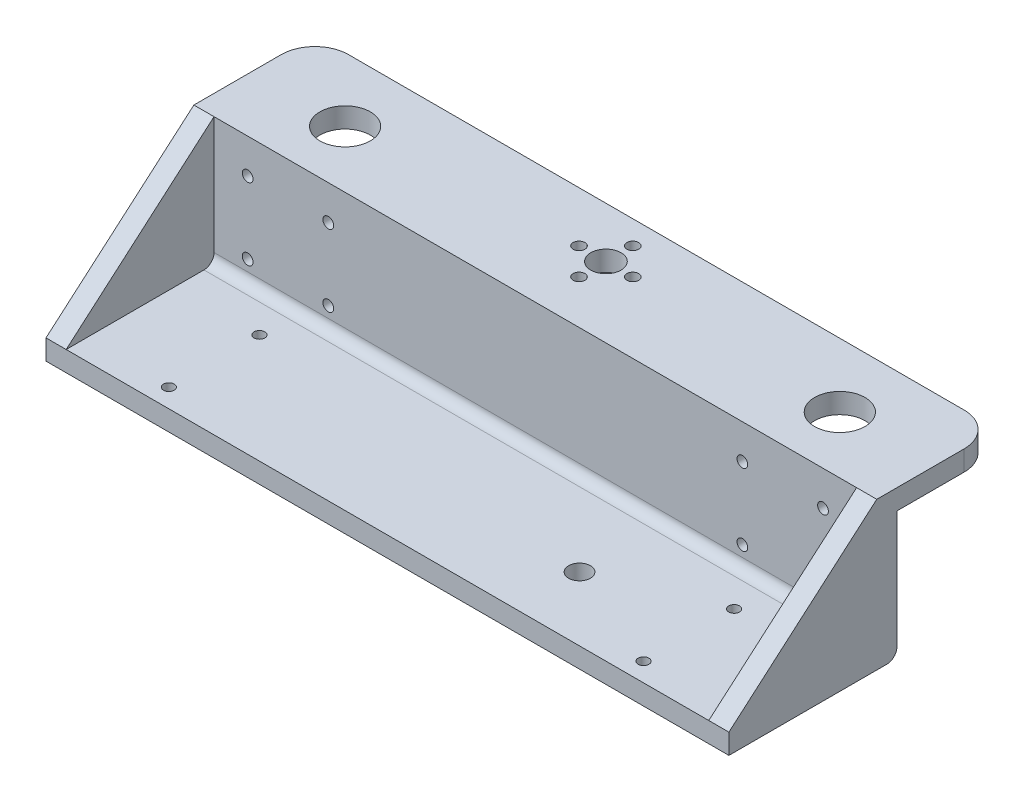
from build123d import *

# Parameters (mm, degrees)
ESQUISSE1_W             = 203.2
ESQUISSE1_H             = 32
BOSS_EXTRU_1_DEPTH      = 6
ESQUISSE2_W             = 203.2
ESQUISSE2_H             = 36
BOSS_EXTRU_2_DEPTH      = 6
ESQUISSE3_R             = 7.5
ESQUISSE3_R_2           = 4.5
ESQUISSE3_R_3           = 1.75
ENL_V_MAT_EXTRU_1_DEPTH = 113.545812894
ESQUISSE6_W             = 203.2
ESQUISSE6_H             = 50
BOSS_EXTRU_4_DEPTH      = 6
BOSS_EXTRU_5_DEPTH      = 6
CONG_3_R                = 3
CONG_4_R                = 10
D_GAGEMENT_M31_D        = 3.2
D_GAGEMENT_M31_DEPTH    = 6
D_GAGEMENT_M31_TIP      = 0.96137699
ESQUISSE11_R            = 3.2385
ENL_V_MAT_EXTRU_3_DEPTH = 6
D_GAGEMENT_M32_D        = 3.2
D_GAGEMENT_M32_DEPTH    = 6
D_GAGEMENT_M32_TIP      = 0.96137699


with BuildPart() as part:
    # Esquisse1 → Boss.-Extru.1 (new body)
    with BuildSketch(Plane.XY):
        Rectangle(ESQUISSE1_W, ESQUISSE1_H)
    extrude(amount=BOSS_EXTRU_1_DEPTH)

    # Esquisse2 → Boss.-Extru.2 (add)
    with BuildSketch(Plane(origin=(0, 16, 0), x_dir=(1, 0, 0), z_dir=(0, 1, 0))):
        with Locations((0, 12)):
            Rectangle(ESQUISSE2_W, ESQUISSE2_H)
    extrude(amount=BOSS_EXTRU_2_DEPTH)

    # Esquisse3 → Enlèv. mat.-Extru.1 (cut, through all)
    with BuildSketch(Plane(origin=(0, 22, 0), x_dir=(1, 0, 0), z_dir=(0, 1, 0))):
        with Locations(Location((-73.6, 11, 0), (0, 0, 270))):
            Circle(ESQUISSE3_R)
        with Locations(Location((73.6, 11, 0), (0, 0, 270))):
            Circle(ESQUISSE3_R)
        with Locations(Location((0, 15, 0), (0, 0, 270))):
            Circle(ESQUISSE3_R_2)
        with Locations(Location((0, 23, 0), (0, 0, 270))):
            Circle(ESQUISSE3_R_3)
        with Locations(Location((0, 7, 0), (0, 0, 270))):
            Circle(ESQUISSE3_R_3)
        with Locations(Location((8, 15, 0), (0, 0, 270))):
            Circle(ESQUISSE3_R_3)
        with Locations(Location((-8, 15, 0), (0, 0, 270))):
            Circle(ESQUISSE3_R_3)
    extrude(amount=-ENL_V_MAT_EXTRU_1_DEPTH, mode=Mode.SUBTRACT)

    # Esquisse6 → Boss.-Extru.4 (add)
    with BuildSketch(Plane.XZ.offset(16)):
        with Locations((0, 25)):
            Rectangle(ESQUISSE6_W, ESQUISSE6_H)
    extrude(amount=BOSS_EXTRU_4_DEPTH)

    # Esquisse7 → Boss.-Extru.5 (add)
    with BuildSketch(Plane(origin=(101.6, 0, 0), x_dir=(0, 0, -1), z_dir=(1, 0, 0))):
        Polygon((-50, -16), (-6, 22), (0, 22), (0, -16), align=None)
    boss_extru_5 = extrude(amount=-BOSS_EXTRU_5_DEPTH)

    # Symétrie1: Boss.-Extru.5 across plane
    add(boss_extru_5.mirror(Plane(origin=(0, 0, 0), x_dir=(0, 0, 1), z_dir=(1, 0, 0))))

    # Congé3
    cong_3_edges = [part.edges().sort_by_distance(p)[0] for p in [
        (0, -16, 6),
        (0, -22, 0),
    ]]
    fillet(cong_3_edges, radius=CONG_3_R)

    # Congé4
    cong_4_edges = [part.edges().sort_by_distance(p)[0] for p in [
        (101.6, 19, -30),
        (-101.6, 19, -30),
    ]]
    fillet(cong_4_edges, radius=CONG_4_R)

    # Dégagement M31
    with Locations(Plane(origin=(85.6, 11.7, 0), x_dir=(-1, 0, 0), z_dir=(0, 0, -1))):
        with Locations((0, 0), (24, 0), (0, -21.4), (24, -21.4), (147.2, 0), (171.2, 0), (147.2, -21.4), (171.2, -21.4)):
            Hole(D_GAGEMENT_M31_D / 2, depth=D_GAGEMENT_M31_DEPTH)
            with Locations((0, 0, -(D_GAGEMENT_M31_DEPTH + D_GAGEMENT_M31_TIP / 2))):  # 118° drill point
                Cone(0, D_GAGEMENT_M31_D / 2, D_GAGEMENT_M31_TIP, mode=Mode.SUBTRACT)

    # Esquisse11 → Enlèv. mat.-Extru.3 (cut)
    with BuildSketch(Plane.XZ.offset(22)):
        with Locations(Location((38.1, 30.95, 0), (0, 0, 270))):
            Circle(ESQUISSE11_R)
    extrude(amount=-ENL_V_MAT_EXTRU_3_DEPTH, mode=Mode.SUBTRACT)

    # Dégagement M32
    with Locations(Plane(origin=(-70.62, -16, 17.48), x_dir=(0, 0, 1), z_dir=(0, 1, 0))):
        with Locations((0, 0), (26.94, 0), (0, 141.24), (26.94, 141.24)):
            Hole(D_GAGEMENT_M32_D / 2, depth=D_GAGEMENT_M32_DEPTH)
            with Locations((0, 0, -(D_GAGEMENT_M32_DEPTH + D_GAGEMENT_M32_TIP / 2))):  # 118° drill point
                Cone(0, D_GAGEMENT_M32_D / 2, D_GAGEMENT_M32_TIP, mode=Mode.SUBTRACT)


solid = part.part
